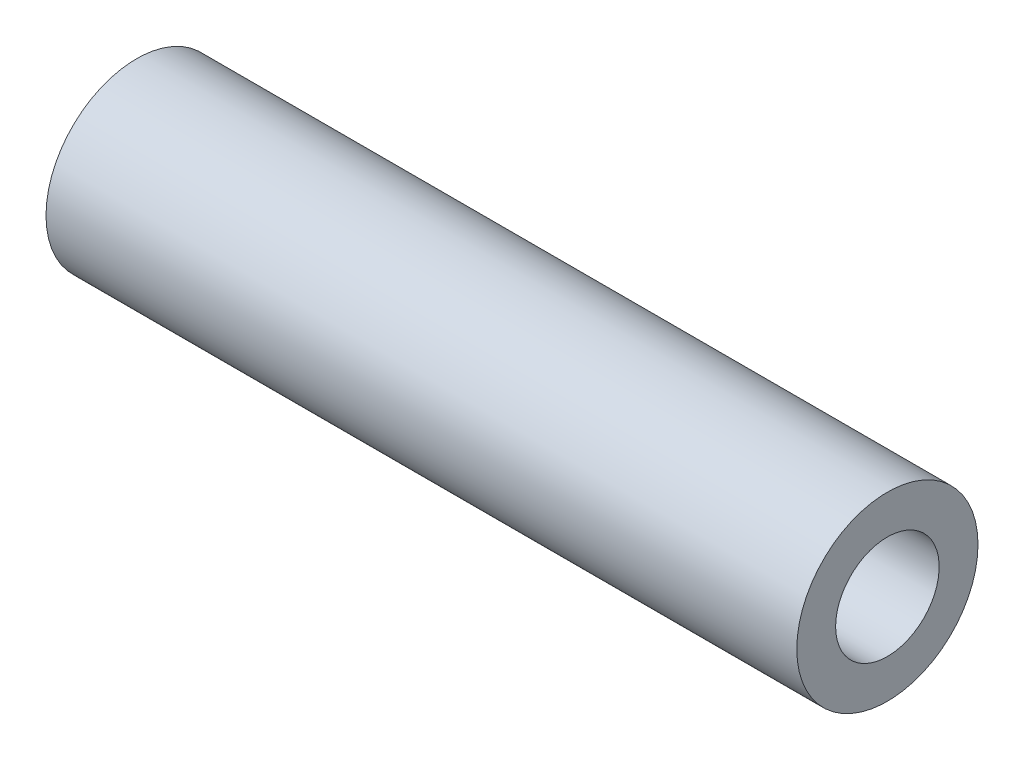
from build123d import *

# Parameters (mm, degrees)
SKETCH_1_W = 58
SKETCH_1_H = 3


with BuildPart() as part:
    # ｽｹｯﾁ1 → 回転1 (revolve)
    with BuildSketch(Plane.XY, mode=Mode.PRIVATE) as revolve_1_sk:
        with Locations((0, 5.5)):
            Rectangle(SKETCH_1_W, SKETCH_1_H)
    revolve(revolve_1_sk.sketch.rotate(Axis((0, 0, 0), (1, 0, 0)), 90), axis=Axis((0, 0, 0), (1, 0, 0)))


solid = part.part
